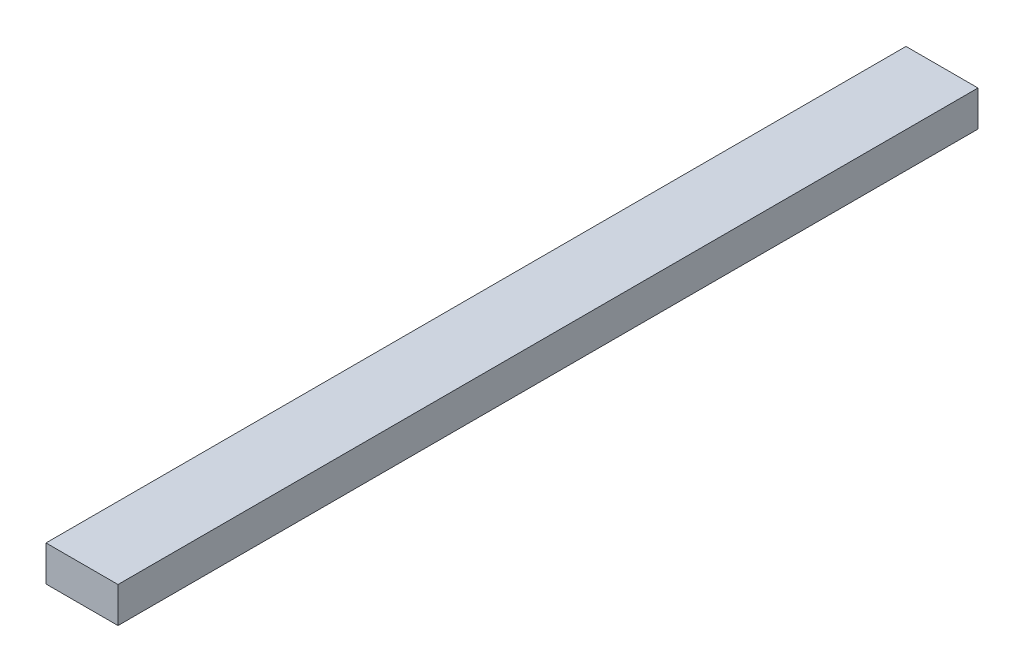
from build123d import *

# Parameters (mm, degrees)
SKETCH1_W           = 12.14
SKETCH1_H           = 6
BOSS_EXTRUDE1_DEPTH = 145


with BuildPart() as part:
    # Sketch1 → Boss-Extrude1 (new body)
    with BuildSketch(Plane.XY):
        Rectangle(SKETCH1_W, SKETCH1_H)
    extrude(amount=BOSS_EXTRUDE1_DEPTH)


solid = part.part
